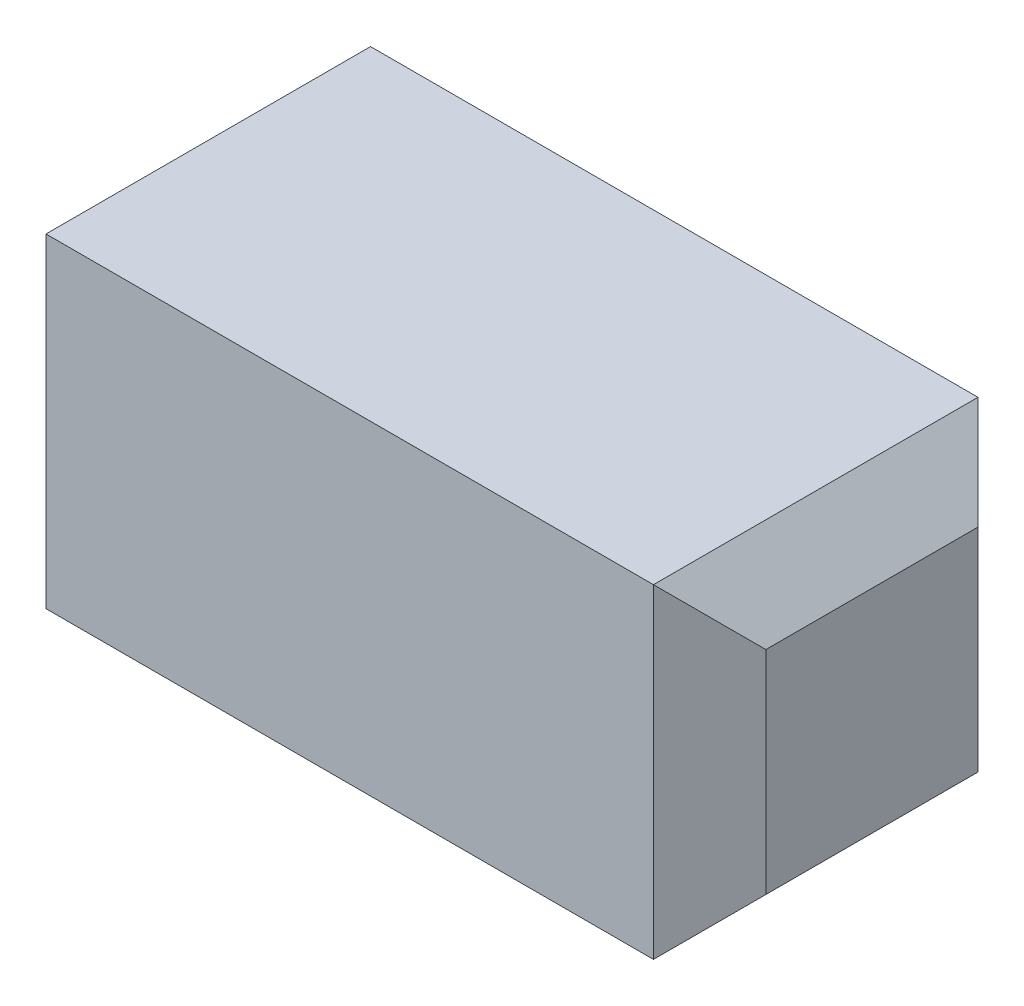
from build123d import *

# Parameters (mm, degrees)
SKETCH1_W           = 4.400325499
SKETCH1_H           = 4.400325499
BOSS_EXTRUDE1_DEPTH = 9.76
CHAMFER1_SIZE       = 0.762


with BuildPart() as part:
    # Sketch1 → Boss-Extrude1 (new body)
    with BuildSketch(Plane(origin=(0, 0, 0), x_dir=(0, 0, -1), z_dir=(1, 0, 0))):
        with Locations((2.20016275, 2.20016275)):
            Rectangle(SKETCH1_W, SKETCH1_H)
    extrude(amount=BOSS_EXTRUDE1_DEPTH)

    # Chamfer1
    chamfer1_edges = [part.edges().sort_by_distance(p)[0] for p in [
        (9.76, 2.20016275, -4.400325499),
        (9.76, 4.400325499, -2.20016275),
        (9.76, 2.20016275, 0),
        (0, 4.400325499, -2.20016275),
        (0, 2.20016275, -4.400325499),
        (0, 0, -2.20016275),
        (0, 2.20016275, 0),
        (9.76, 0, -2.20016275),
    ]]
    chamfer(chamfer1_edges, length=CHAMFER1_SIZE)


solid = part.part
